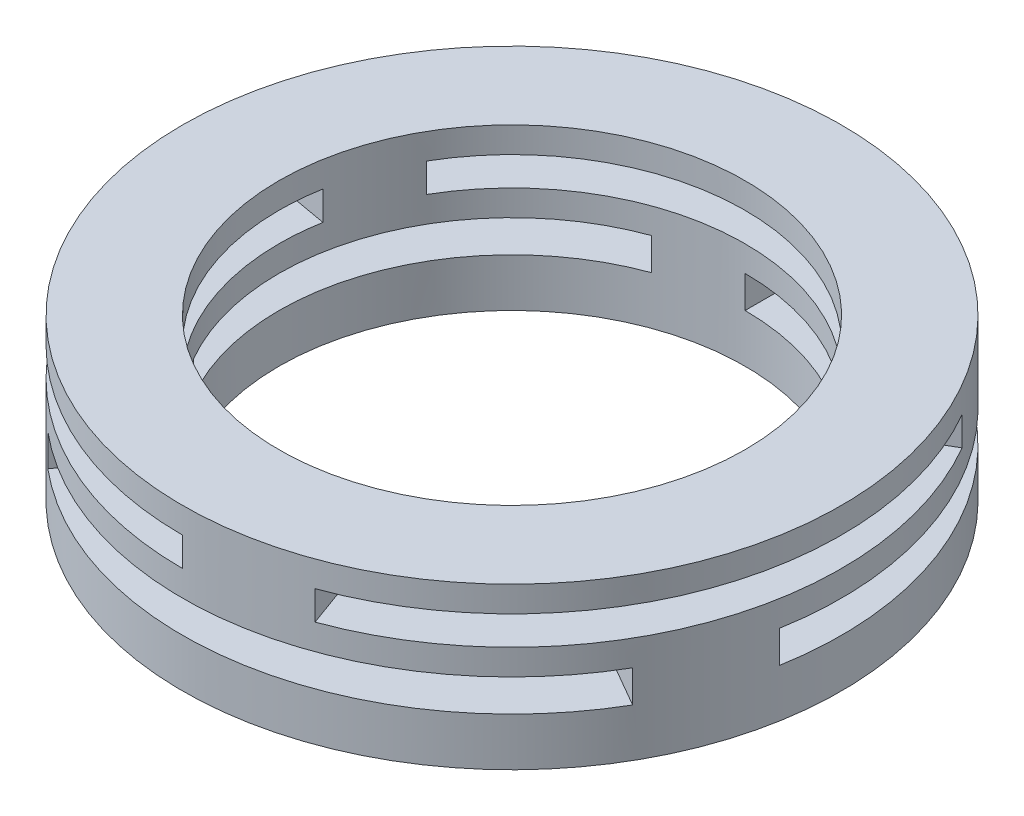
from build123d import *

# Parameters (mm, degrees)
ESBO_O9_W             = 3
ESBO_O9_H             = 5
CORTE_EXTRUS_O1_START = 1
CORTE_EXTRUS_O1_DEPTH = 1
PADR_OCIRCULAR2_COUNT = 3
CORTE_EXTRUS_O3_START = 0.9
CORTE_EXTRUS_O3_DEPTH = 0.9
PADR_OCIRCULAR4_COUNT = 3


with BuildPart() as part:
    # Esboço9 → Revolução1 (revolve)
    with BuildSketch(Plane.XY, mode=Mode.PRIVATE) as revolu_o1_sk:
        with Locations((8.75, 2.5)):
            Rectangle(ESBO_O9_W, ESBO_O9_H)
    revolve(revolu_o1_sk.sketch.rotate(Axis((0, -112.760074913, 0), (0, 1, 0)), 180), axis=Axis((0, -112.760074913, 0), (0, 1, 0)))

    # Esboço12 → Corte-extrusão1 (cut)
    with BuildSketch(Plane(origin=(0, 1.5, 0), x_dir=(1, 0, 0), z_dir=(0, 1, 0)).offset(CORTE_EXTRUS_O1_START)):
        with BuildLine():
            Line((0, 10.25), (0, 5.5))
            ThreePointArc((0, 5.5), (4.213244437, 3.535331853), (5.416442642, -0.955064977))
            Line((5.416442642, -0.955064977), (10.094279468, -1.779893821))
            ThreePointArc((10.094279468, -1.779893821), (7.851955542, 6.588572999), (0, 10.25))
        make_face()
    corte_extrus_o1 = extrude(amount=-CORTE_EXTRUS_O1_DEPTH, mode=Mode.SUBTRACT)

    # PadrãoCircular2: Corte-extrusão1 ×3 about axis
    padr_ocircular2_axis = Axis((0, 0, 0), (0, 1, 0))
    for i in range(1, PADR_OCIRCULAR2_COUNT):
        add(corte_extrus_o1.rotate(padr_ocircular2_axis, i * 360 / PADR_OCIRCULAR2_COUNT), mode=Mode.SUBTRACT)

    # Esboço13 → Corte-extrusão3 (cut)
    with BuildSketch(Plane(origin=(0, 3.3, 0), x_dir=(1, 0, 0), z_dir=(0, 1, 0)).offset(CORTE_EXTRUS_O3_START)):
        with BuildLine():
            Line((0, 0), (8.876760389, 5.125))
            ThreePointArc((8.876760389, 5.125), (9.631849363, -3.505706469), (3.505706469, -9.631849363))
            Line((3.505706469, -9.631849363), (0, 0))
        make_face()
    corte_extrus_o3 = extrude(amount=-CORTE_EXTRUS_O3_DEPTH, mode=Mode.SUBTRACT)

    # PadrãoCircular4: Corte-extrusão3 ×3 about axis
    padr_ocircular4_axis = Axis((0, 0, 0), (0, 1, 0))
    for i in range(1, PADR_OCIRCULAR4_COUNT):
        add(corte_extrus_o3.rotate(padr_ocircular4_axis, i * 360 / PADR_OCIRCULAR4_COUNT), mode=Mode.SUBTRACT)


solid = part.part
